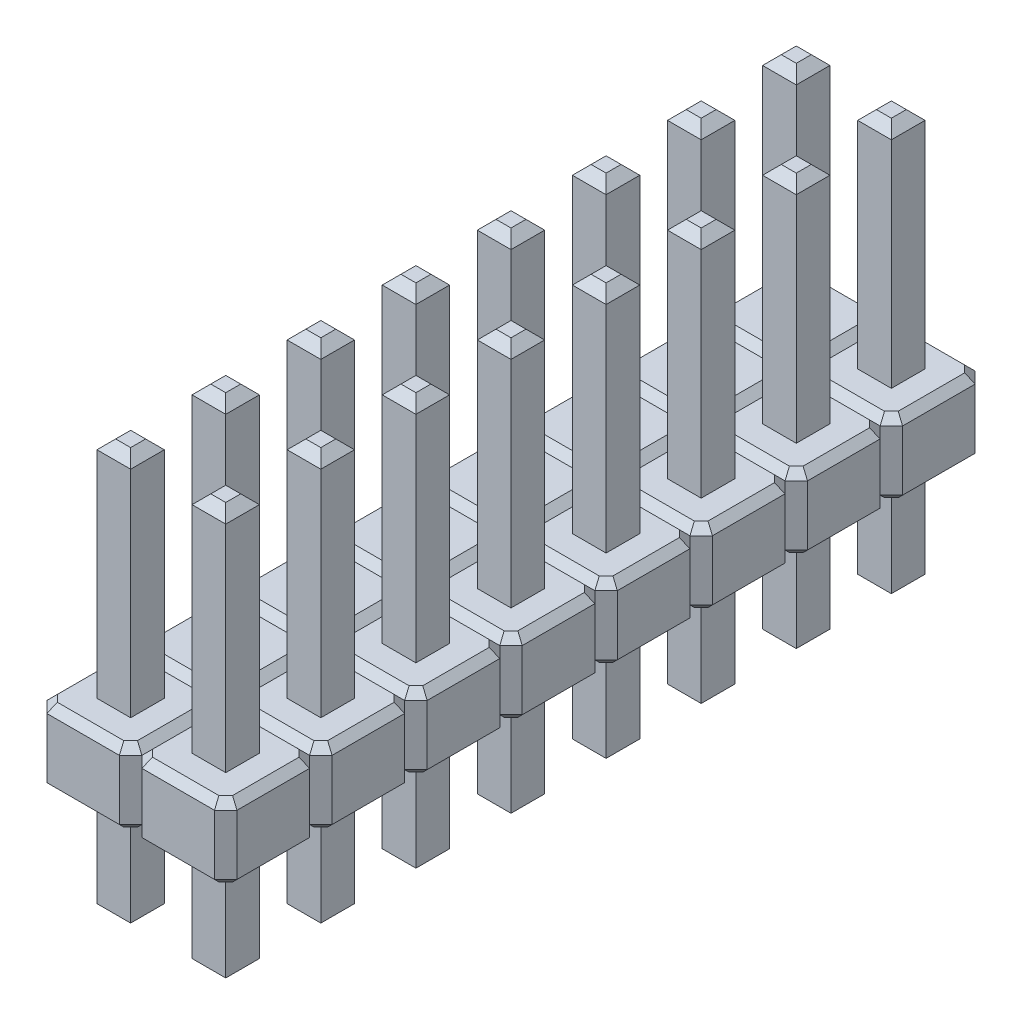
from build123d import *

# Parameters (mm, degrees)
SKETCH_1_W               = 0.9
SKETCH_1_H               = 0.9
METAL_PART_DEPTH         = 11
PLASTIC_START            = 3
PLASTIC_PART_DEPTH       = 2
CHAMFER_1_SIZE           = 0.2
CHAMFER_2_SIZE           = 0.25
PATTERN_LINEAR_1_COUNT   = 8
PATTERN_LINEAR_1_PITCH   = 2.54
PATTERN_LINEAR_1_2_COUNT = 2
PATTERN_LINEAR_1_2_PITCH = 2.54


with BuildPart() as part:
    # Эскиз1 → metal part (new body)
    with BuildSketch(Plane(origin=(0, 0, 0), x_dir=(1, 0, 0), z_dir=(0, 1, 0))):
        Rectangle(SKETCH_1_W, SKETCH_1_H)
    extrude(amount=METAL_PART_DEPTH)

    # Фаска2
    chamfer_2_edges = [part.edges().sort_by_distance(p)[0] for p in [
        (0, 0, 0.45),
        (0.45, 0, 0),
        (0, 0, -0.45),
        (-0.45, 0, 0),
        (0.45, 11, 0),
        (0, 11, -0.45),
        (0, 11, 0.45),
        (-0.45, 11, 0),
    ]]
    chamfer(chamfer_2_edges, length=CHAMFER_2_SIZE)


with BuildPart() as body_2:
    # Эскиз1<3> → plastic part (new body)
    with BuildSketch(Plane(origin=(0, 0, 0), x_dir=(1, 0, 0), z_dir=(0, 1, 0)).offset(PLASTIC_START)):
        Polygon((-0.97, -1.27), (0.97, -1.27), (1.27, -0.97), (1.27, 0.97), (0.97, 1.27), (-0.97, 1.27), (-1.27, 0.97), (-1.27, -0.97), align=None)
    extrude(amount=PLASTIC_PART_DEPTH)

    # Фаска1
    chamfer_1_edges = [body_2.edges().sort_by_distance(p)[0] for p in [
        (1.12, 3, -1.12),
        (1.27, 3, 0),
        (1.12, 3, 1.12),
        (0, 3, 1.27),
        (-1.12, 3, 1.12),
        (-1.27, 3, 0),
        (-1.12, 3, -1.12),
        (0, 3, -1.27),
        (1.12, 5, -1.12),
        (0, 5, -1.27),
        (-1.12, 5, -1.12),
        (-1.27, 5, 0),
        (-1.12, 5, 1.12),
        (1.27, 5, 0),
        (1.12, 5, 1.12),
        (0, 5, 1.27),
    ]]
    chamfer(chamfer_1_edges, length=CHAMFER_1_SIZE)


with BuildPart() as pattern_linear_1_1:
    # Линейный массив1: pattern copy
    add(body_2.part.moved(Location(Vector(0, 0, -1) * (1 * PATTERN_LINEAR_1_PITCH))))


with BuildPart() as pattern_linear_1_2:
    # Линейный массив1: pattern copy
    add(body_2.part.moved(Location(Vector(0, 0, -1) * (2 * PATTERN_LINEAR_1_PITCH))))


with BuildPart() as pattern_linear_1_3:
    # Линейный массив1: pattern copy
    add(body_2.part.moved(Location(Vector(0, 0, -1) * (3 * PATTERN_LINEAR_1_PITCH))))


with BuildPart() as pattern_linear_1_4:
    # Линейный массив1: pattern copy
    add(body_2.part.moved(Location(Vector(0, 0, -1) * (4 * PATTERN_LINEAR_1_PITCH))))


with BuildPart() as pattern_linear_1_5:
    # Линейный массив1: pattern copy
    add(body_2.part.moved(Location(Vector(0, 0, -1) * (5 * PATTERN_LINEAR_1_PITCH))))


with BuildPart() as pattern_linear_1_6:
    # Линейный массив1: pattern copy
    add(body_2.part.moved(Location(Vector(0, 0, -1) * (6 * PATTERN_LINEAR_1_PITCH))))


with BuildPart() as pattern_linear_1_7:
    # Линейный массив1: pattern copy
    add(body_2.part.moved(Location(Vector(0, 0, -1) * (7 * PATTERN_LINEAR_1_PITCH))))


with BuildPart() as pattern_linear_1_8:
    # Линейный массив1: pattern copy
    add(part.part.moved(Location(Vector(0, 0, -1) * (1 * PATTERN_LINEAR_1_PITCH))))


with BuildPart() as pattern_linear_1_9:
    # Линейный массив1: pattern copy
    add(part.part.moved(Location(Vector(0, 0, -1) * (2 * PATTERN_LINEAR_1_PITCH))))


with BuildPart() as pattern_linear_1_10:
    # Линейный массив1: pattern copy
    add(part.part.moved(Location(Vector(0, 0, -1) * (3 * PATTERN_LINEAR_1_PITCH))))


with BuildPart() as pattern_linear_1_11:
    # Линейный массив1: pattern copy
    add(part.part.moved(Location(Vector(0, 0, -1) * (4 * PATTERN_LINEAR_1_PITCH))))


with BuildPart() as pattern_linear_1_12:
    # Линейный массив1: pattern copy
    add(part.part.moved(Location(Vector(0, 0, -1) * (5 * PATTERN_LINEAR_1_PITCH))))


with BuildPart() as pattern_linear_1_13:
    # Линейный массив1: pattern copy
    add(part.part.moved(Location(Vector(0, 0, -1) * (6 * PATTERN_LINEAR_1_PITCH))))


with BuildPart() as pattern_linear_1_14:
    # Линейный массив1: pattern copy
    add(part.part.moved(Location(Vector(0, 0, -1) * (7 * PATTERN_LINEAR_1_PITCH))))


with BuildPart() as pattern_linear_1_2_1:
    # Pattern Linear 1 2: pattern copy
    add(body_2.part.moved(Location(Vector(1, 0, 0) * (1 * PATTERN_LINEAR_1_2_PITCH))))


with BuildPart() as pattern_linear_1_2_2:
    # Pattern Linear 1 2: pattern copy
    add(part.part.moved(Location(Vector(1, 0, 0) * (1 * PATTERN_LINEAR_1_2_PITCH))))


with BuildPart() as pattern_linear_1_2_3:
    # Pattern Linear 1 2: pattern copy
    add(pattern_linear_1_1.part.moved(Location(Vector(1, 0, 0) * (1 * PATTERN_LINEAR_1_2_PITCH))))


with BuildPart() as pattern_linear_1_2_4:
    # Pattern Linear 1 2: pattern copy
    add(pattern_linear_1_2.part.moved(Location(Vector(1, 0, 0) * (1 * PATTERN_LINEAR_1_2_PITCH))))


with BuildPart() as pattern_linear_1_2_5:
    # Pattern Linear 1 2: pattern copy
    add(pattern_linear_1_3.part.moved(Location(Vector(1, 0, 0) * (1 * PATTERN_LINEAR_1_2_PITCH))))


with BuildPart() as pattern_linear_1_2_6:
    # Pattern Linear 1 2: pattern copy
    add(pattern_linear_1_4.part.moved(Location(Vector(1, 0, 0) * (1 * PATTERN_LINEAR_1_2_PITCH))))


with BuildPart() as pattern_linear_1_2_7:
    # Pattern Linear 1 2: pattern copy
    add(pattern_linear_1_5.part.moved(Location(Vector(1, 0, 0) * (1 * PATTERN_LINEAR_1_2_PITCH))))


with BuildPart() as pattern_linear_1_2_8:
    # Pattern Linear 1 2: pattern copy
    add(pattern_linear_1_6.part.moved(Location(Vector(1, 0, 0) * (1 * PATTERN_LINEAR_1_2_PITCH))))


with BuildPart() as pattern_linear_1_2_9:
    # Pattern Linear 1 2: pattern copy
    add(pattern_linear_1_7.part.moved(Location(Vector(1, 0, 0) * (1 * PATTERN_LINEAR_1_2_PITCH))))


with BuildPart() as pattern_linear_1_2_10:
    # Pattern Linear 1 2: pattern copy
    add(pattern_linear_1_8.part.moved(Location(Vector(1, 0, 0) * (1 * PATTERN_LINEAR_1_2_PITCH))))


with BuildPart() as pattern_linear_1_2_11:
    # Pattern Linear 1 2: pattern copy
    add(pattern_linear_1_9.part.moved(Location(Vector(1, 0, 0) * (1 * PATTERN_LINEAR_1_2_PITCH))))


with BuildPart() as pattern_linear_1_2_12:
    # Pattern Linear 1 2: pattern copy
    add(pattern_linear_1_10.part.moved(Location(Vector(1, 0, 0) * (1 * PATTERN_LINEAR_1_2_PITCH))))


with BuildPart() as pattern_linear_1_2_13:
    # Pattern Linear 1 2: pattern copy
    add(pattern_linear_1_11.part.moved(Location(Vector(1, 0, 0) * (1 * PATTERN_LINEAR_1_2_PITCH))))


with BuildPart() as pattern_linear_1_2_14:
    # Pattern Linear 1 2: pattern copy
    add(pattern_linear_1_12.part.moved(Location(Vector(1, 0, 0) * (1 * PATTERN_LINEAR_1_2_PITCH))))


with BuildPart() as pattern_linear_1_2_15:
    # Pattern Linear 1 2: pattern copy
    add(pattern_linear_1_13.part.moved(Location(Vector(1, 0, 0) * (1 * PATTERN_LINEAR_1_2_PITCH))))


with BuildPart() as pattern_linear_1_2_16:
    # Pattern Linear 1 2: pattern copy
    add(pattern_linear_1_14.part.moved(Location(Vector(1, 0, 0) * (1 * PATTERN_LINEAR_1_2_PITCH))))


with BuildPart() as pattern_linear_1_1_1:
    add(pattern_linear_1_1.part)

    # Combine 2: union Линейный массив1 2_3, Линейный массив1 2_4, Линейный массив1_2, body 2, Линейный массив1 2_1, Линейный массив1 2_5, Линейный массив1_3, Линейный массив1 2_6, Линейный массив1_4, Линейный массив1 2_7, Линейный массив1_5, Линейный массив1 2_8, Линейный массив1_6, Линейный массив1 2_9, Линейный массив1_7
    add(pattern_linear_1_2_3.part)
    add(pattern_linear_1_2_4.part)
    add(pattern_linear_1_2.part)
    add(body_2.part)
    add(pattern_linear_1_2_1.part)
    add(pattern_linear_1_2_5.part)
    add(pattern_linear_1_3.part)
    add(pattern_linear_1_2_6.part)
    add(pattern_linear_1_4.part)
    add(pattern_linear_1_2_7.part)
    add(pattern_linear_1_5.part)
    add(pattern_linear_1_2_8.part)
    add(pattern_linear_1_6.part)
    add(pattern_linear_1_2_9.part)
    add(pattern_linear_1_7.part)


solid = Compound([part.part, pattern_linear_1_8.part, pattern_linear_1_9.part, pattern_linear_1_10.part, pattern_linear_1_11.part, pattern_linear_1_12.part, pattern_linear_1_13.part, pattern_linear_1_14.part, pattern_linear_1_2_2.part, pattern_linear_1_2_10.part, pattern_linear_1_2_11.part, pattern_linear_1_2_12.part, pattern_linear_1_2_13.part, pattern_linear_1_2_14.part, pattern_linear_1_2_15.part, pattern_linear_1_2_16.part, pattern_linear_1_1_1.part])
